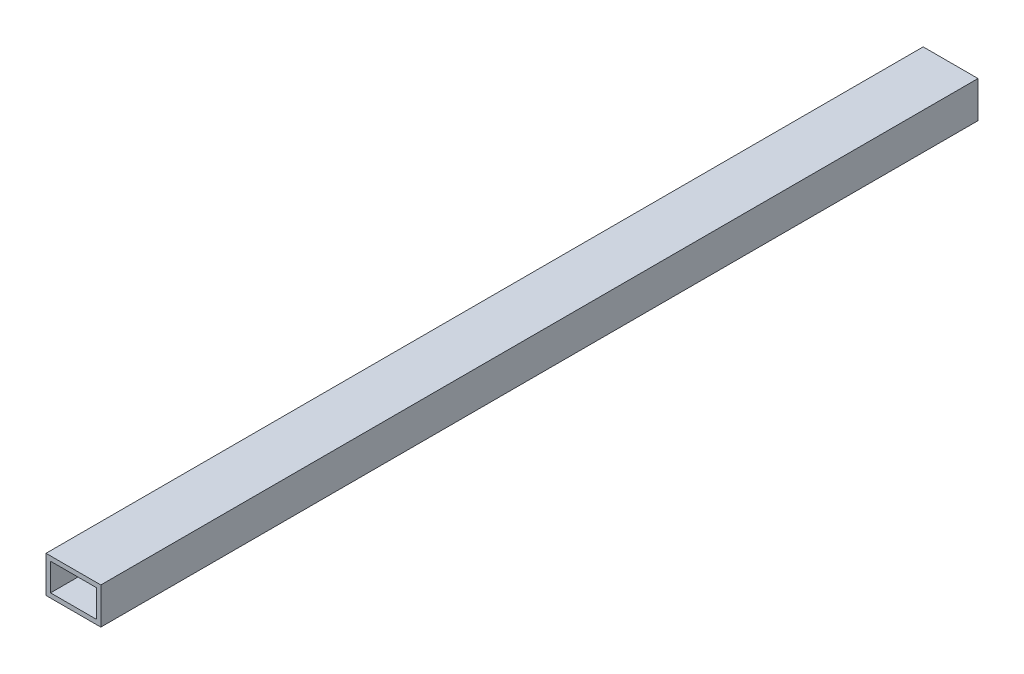
from build123d import *

# Parameters (mm, degrees)
BOSS_EXTRUDE1_DEPTH      = 304.8
BOSS_EXTRUDE1_DEPTH_BACK = 304.8
SKETCH3_W                = 38.1
SKETCH3_H                = 25.4
SKETCH3_W_2              = 31.75
SKETCH3_H_2              = 19.05


with BuildPart() as part:
    # Sketch3 → Boss-Extrude1 (new, two sides: drawn at the far end of the back side and taken through both)
    with BuildSketch(Plane.XY.offset(-BOSS_EXTRUDE1_DEPTH_BACK)):
        Rectangle(SKETCH3_W, SKETCH3_H)
        Rectangle(SKETCH3_W_2, SKETCH3_H_2, mode=Mode.SUBTRACT)
    extrude(amount=BOSS_EXTRUDE1_DEPTH + BOSS_EXTRUDE1_DEPTH_BACK)


solid = part.part
